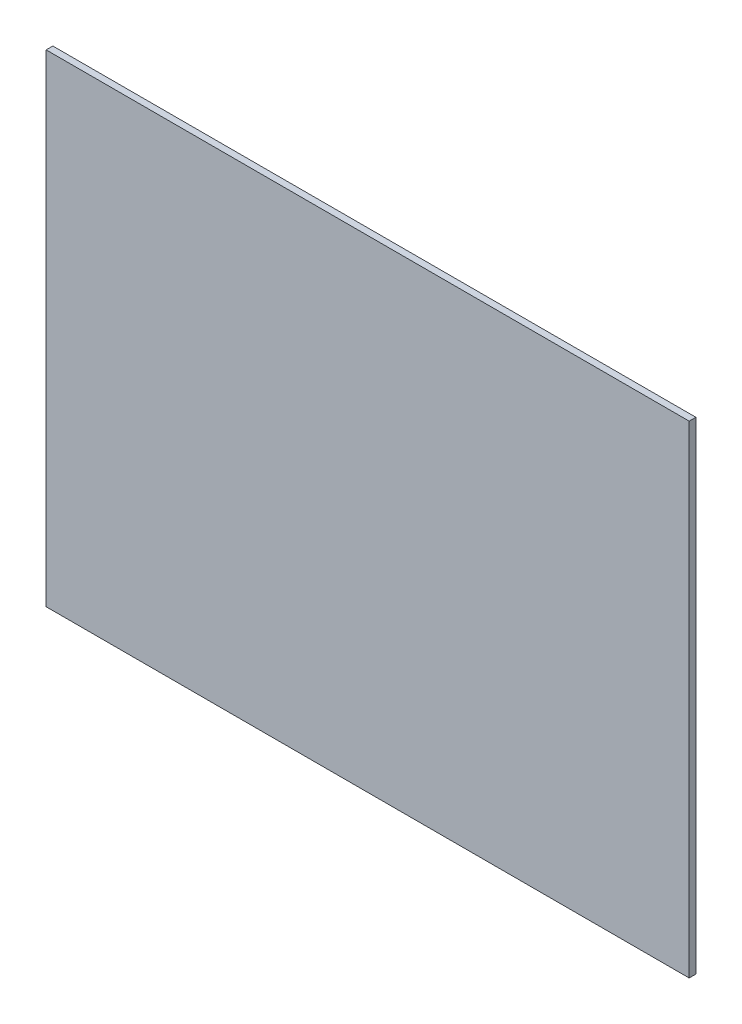
from build123d import *

# Parameters (mm, degrees)
SKETCH2_W           = 609.6
SKETCH2_H           = 457.2
BOSS_EXTRUDE1_DEPTH = 6.35


with BuildPart() as part:
    # Sketch2 → Boss-Extrude1 (new body)
    with BuildSketch(Plane.XY):
        Rectangle(SKETCH2_W, SKETCH2_H)
    extrude(amount=BOSS_EXTRUDE1_DEPTH)


solid = part.part
